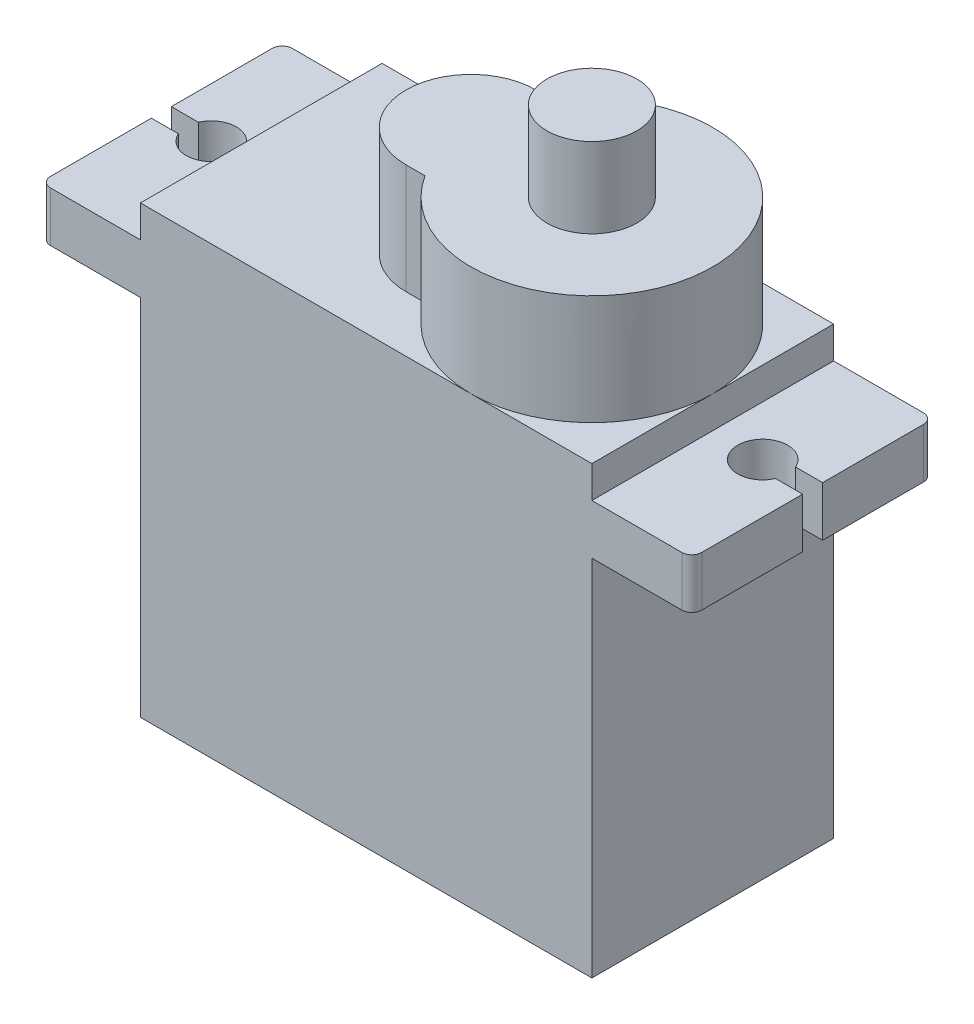
from build123d import *

# Parameters (mm, degrees)
SKETCH1_W           = 22.6
SKETCH1_H           = 12.1
BOSS_EXTRUDE1_DEPTH = 22.3
SKETCH2_W           = 12.1
SKETCH2_H           = 2.5
BOSS_EXTRUDE2_DEPTH = 5
BOSS_EXTRUDE3_DEPTH = 5.5
SKETCH4_R           = 2.25
BOSS_EXTRUDE4_DEPTH = 4
CUT_EXTRUDE1_REACH  = 29.033
FILLET1_R           = 0.5


with BuildPart() as part:
    # Sketch1 → Boss-Extrude1 (new body)
    with BuildSketch(Plane(origin=(0, 0, 0), x_dir=(1, 0, 0), z_dir=(0, 1, 0))):
        Rectangle(SKETCH1_W, SKETCH1_H)
    extrude(amount=BOSS_EXTRUDE1_DEPTH)

    # Sketch2 → Boss-Extrude2 (add)
    with BuildSketch(Plane(origin=(11.3, 0, 0), x_dir=(0, 0, -1), z_dir=(1, 0, 0))):
        with Locations((0, 19.45)):
            Rectangle(SKETCH2_W, SKETCH2_H)
    boss_extrude2 = extrude(amount=BOSS_EXTRUDE2_DEPTH)

    # Mirror1: Boss-Extrude2 across plane
    add(boss_extrude2.mirror(Plane(origin=(0, 0, 0), x_dir=(0, 0, 1), z_dir=(1, 0, 0))))

    # Sketch3 → Boss-Extrude3 (add)
    with BuildSketch(Plane(origin=(0, 22.3, 0), x_dir=(1, 0, 0), z_dir=(0, 1, 0))):
        with BuildLine():
            ThreePointArc((-0.8, 3.25), (-4.05, 0), (-0.8, -3.25))
            Line((-0.8, -3.25), (0.147059671, -3.25))
            ThreePointArc((0.147059671, -3.25), (11.3, 0), (0.147059671, 3.25))
            Line((0.147059671, 3.25), (-0.8, 3.25))
        make_face()
    extrude(amount=BOSS_EXTRUDE3_DEPTH)

    # Sketch4 → Boss-Extrude4 (add)
    with BuildSketch(Plane(origin=(0, 27.8, 0), x_dir=(1, 0, 0), z_dir=(0, 1, 0))):
        with Locations(Location((5.25, 0, 0), (0, 0, 270))):
            Circle(SKETCH4_R)
    extrude(amount=BOSS_EXTRUDE4_DEPTH)

    # Sketch6 → Cut-Extrude1 (cut, up to next)
    with BuildSketch(Plane(origin=(0, 20.7, 0), x_dir=(1, 0, 0), z_dir=(0, 1, 0)), mode=Mode.PRIVATE) as cut_extrude1_sk1:
        with BuildLine():
            Line((16.3, -0.5), (16.3, 0))
            Line((16.3, 0), (15.05, 0))
            ThreePointArc((15.05, 0), (15.023632891, -0.255387055), (14.945643924, -0.5))
            Line((14.945643924, -0.5), (16.3, -0.5))
        make_face()
    cut_extrude1_tool1 = extrude(cut_extrude1_sk1.sketch, amount=-CUT_EXTRUDE1_REACH, mode=Mode.PRIVATE) & part.part
    # Sketch6 → Cut-Extrude1 (cut, up to next)
    with BuildSketch(Plane(origin=(0, 20.7, 0), x_dir=(1, 0, 0), z_dir=(0, 1, 0)), mode=Mode.PRIVATE) as cut_extrude1_sk2:
        with BuildLine():
            Line((15.05, 0), (16.3, 0))
            Line((16.3, 0), (16.3, 0.5))
            Line((16.3, 0.5), (14.945643924, 0.5))
            ThreePointArc((14.945643924, 0.5), (15.023632891, 0.255387055), (15.05, 0))
        make_face()
    cut_extrude1_tool2 = extrude(cut_extrude1_sk2.sketch, amount=-CUT_EXTRUDE1_REACH, mode=Mode.PRIVATE) & part.part
    # Sketch6 → Cut-Extrude1 (cut, up to next)
    with BuildSketch(Plane(origin=(0, 20.7, 0), x_dir=(1, 0, 0), z_dir=(0, 1, 0)), mode=Mode.PRIVATE) as cut_extrude1_sk3:
        with BuildLine():
            ThreePointArc((14.945643924, -0.5), (15.023632891, -0.255387055), (15.05, 0))
            Line((15.05, 0), (12.55, 0))
            ThreePointArc((12.55, 0), (13.544612945, -1.223632891), (14.945643924, -0.5))
        make_face()
    cut_extrude1_tool3 = extrude(cut_extrude1_sk3.sketch, amount=-CUT_EXTRUDE1_REACH, mode=Mode.PRIVATE) & part.part
    # Sketch6 → Cut-Extrude1 (cut, up to next)
    with BuildSketch(Plane(origin=(0, 20.7, 0), x_dir=(1, 0, 0), z_dir=(0, 1, 0)), mode=Mode.PRIVATE) as cut_extrude1_sk4:
        with BuildLine():
            Line((12.55, 0), (15.05, 0))
            ThreePointArc((15.05, 0), (15.023632891, 0.255387055), (14.945643924, 0.5))
            ThreePointArc((14.945643924, 0.5), (13.544612945, 1.223632891), (12.55, 0))
        make_face()
    cut_extrude1_tool4 = extrude(cut_extrude1_sk4.sketch, amount=-CUT_EXTRUDE1_REACH, mode=Mode.PRIVATE) & part.part
    # Sketch6 → Cut-Extrude1 (cut, up to next)
    with BuildSketch(Plane(origin=(0, 20.7, 0), x_dir=(1, 0, 0), z_dir=(0, 1, 0)), mode=Mode.PRIVATE) as cut_extrude1_sk5:
        with BuildLine():
            ThreePointArc((14.945643924, -0.5), (15.023632891, -0.255387055), (15.05, 0))
            Line((15.05, 0), (12.55, 0))
            ThreePointArc((12.55, 0), (13.544612945, -1.223632891), (14.945643924, -0.5))
        make_face()
    cut_extrude1_tool5 = extrude(cut_extrude1_sk5.sketch, amount=-CUT_EXTRUDE1_REACH, mode=Mode.PRIVATE) & part.part
    # Sketch6 → Cut-Extrude1 (cut, up to next)
    with BuildSketch(Plane(origin=(0, 20.7, 0), x_dir=(1, 0, 0), z_dir=(0, 1, 0)), mode=Mode.PRIVATE) as cut_extrude1_sk6:
        with BuildLine():
            Line((12.55, 0), (15.05, 0))
            ThreePointArc((15.05, 0), (15.023632891, 0.255387055), (14.945643924, 0.5))
            ThreePointArc((14.945643924, 0.5), (13.544612945, 1.223632891), (12.55, 0))
        make_face()
    cut_extrude1_tool6 = extrude(cut_extrude1_sk6.sketch, amount=-CUT_EXTRUDE1_REACH, mode=Mode.PRIVATE) & part.part
    cut_extrude1_1 = cut_extrude1_tool1.solids().sort_by_distance((15.657536, 20.7, 0.253356))[0]
    add(cut_extrude1_1, mode=Mode.SUBTRACT)
    cut_extrude1_2 = cut_extrude1_tool2.solids().sort_by_distance((15.657536, 20.7, -0.253356))[0]
    add(cut_extrude1_2, mode=Mode.SUBTRACT)
    cut_extrude1_3 = cut_extrude1_tool3.solids().sort_by_distance((13.8, 20.7, 0.530516))[0]
    add(cut_extrude1_3, mode=Mode.SUBTRACT)
    cut_extrude1_4 = cut_extrude1_tool4.solids().sort_by_distance((13.8, 20.7, -0.530516))[0]
    add(cut_extrude1_4, mode=Mode.SUBTRACT)
    cut_extrude1_5 = cut_extrude1_tool5.solids().sort_by_distance((13.8, 20.7, 0.530516))[0]
    add(cut_extrude1_5, mode=Mode.SUBTRACT)
    cut_extrude1_6 = cut_extrude1_tool6.solids().sort_by_distance((13.8, 20.7, -0.530516))[0]
    add(cut_extrude1_6, mode=Mode.SUBTRACT)
    cut_extrude1 = cut_extrude1_1 + cut_extrude1_2 + cut_extrude1_3 + cut_extrude1_4 + cut_extrude1_5 + cut_extrude1_6  # Cut-Extrude1 as one shape, for the pattern or mirror that repeats it

    # Mirror2: Cut-Extrude1 across plane
    add(cut_extrude1.mirror(Plane(origin=(0, 0, 0), x_dir=(0, 0, 1), z_dir=(1, 0, 0))), mode=Mode.SUBTRACT)

    # Fillet1
    fillet1_edges = [part.edges().sort_by_distance(p)[0] for p in [
        (16.3, 19.45, -6.05),
        (16.3, 19.45, 6.05),
        (-16.3, 19.45, -6.05),
        (-16.3, 19.45, 6.05),
    ]]
    fillet(fillet1_edges, radius=FILLET1_R)


solid = part.part
